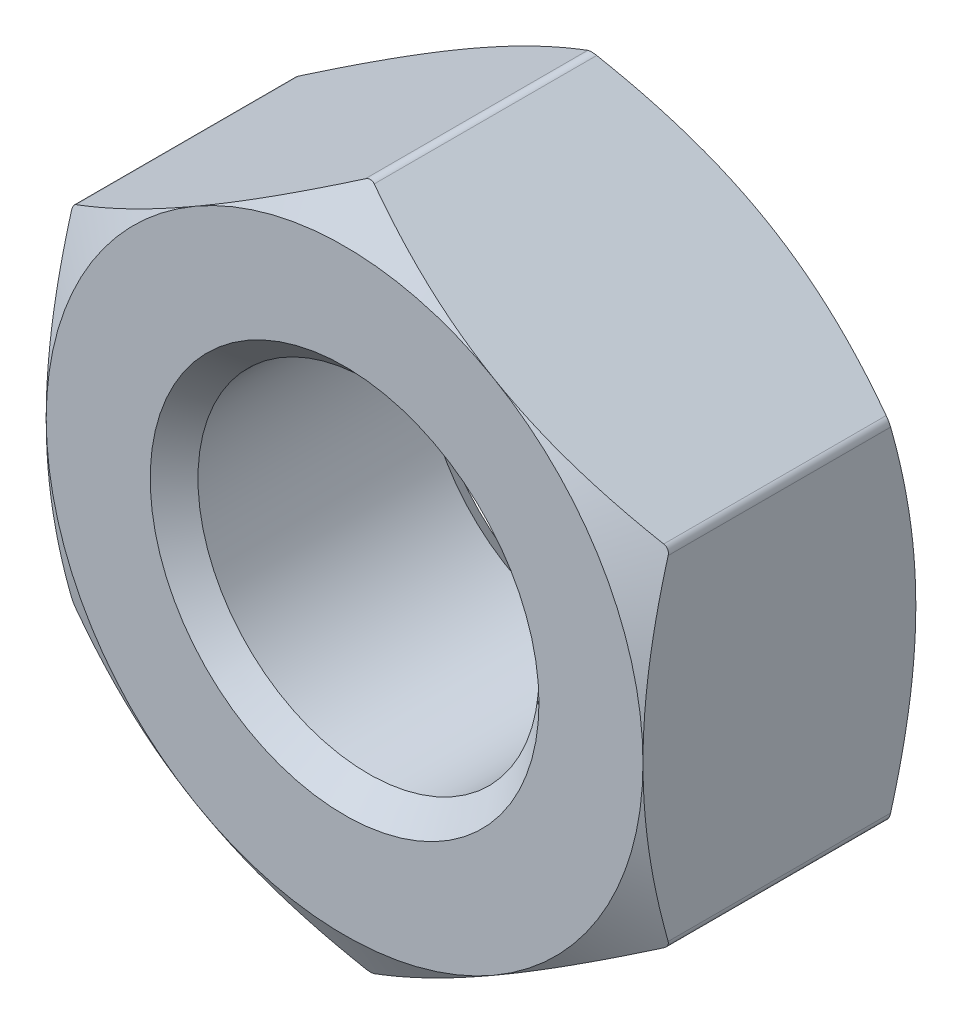
from build123d import *

# Parameters (mm, degrees)
SKETCH3_R           = 2
BOSS_EXTRUDE1_DEPTH = 1.6
SKETCH4_OUTSIDE_W   = 36.28
SKETCH4_OUTSIDE_H   = 37.362
SKETCH4_OUTSIDE_R   = 3.5
CUT_EXTRUDE1_DEPTH  = 7.23083729
CUT_EXTRUDE1_DRAFT  = -60
CUT_EXTRUDE2_START  = -3.2
SKETCH4_2_OUTSIDE_W = 47.366
SKETCH4_2_OUTSIDE_H = 48.448
SKETCH4_2_OUTSIDE_R = 3.5
CUT_EXTRUDE2_DEPTH  = 10.43083729
CUT_EXTRUDE2_DRAFT  = 60
FILLET1_R           = 0.105
CHAMFER1_SIZE       = 0.28


with BuildPart() as part:
    # Sketch3 → Boss-Extrude1 (new, symmetric)
    with BuildSketch(Plane.XY):
        Polygon((0, 4.041451884), (-3.5, 2.020725942), (-3.5, -2.020725942), (0, -4.041451884), (3.5, -2.020725942), (3.5, 2.020725942), align=None)
        Circle(SKETCH3_R, mode=Mode.SUBTRACT)
    extrude(amount=BOSS_EXTRUDE1_DEPTH, both=True)


with BuildPart() as cut_extrude1_tool:
    # Sketch4 outside → Cut-Extrude1 (with draft: the straight prism first)
    with BuildSketch(Plane.XY.offset(1.6)):
        Rectangle(SKETCH4_OUTSIDE_W, SKETCH4_OUTSIDE_H)
        Circle(SKETCH4_OUTSIDE_R, mode=Mode.SUBTRACT)
    extrude(amount=-CUT_EXTRUDE1_DEPTH)
    # Cut-Extrude1: the draft: its side faces are tilted about the plane it starts from
    cut_extrude1_sides = [cut_extrude1_tool.faces().sort_by_distance(p)[0] for p in [
        (0, -18.681, -2.015418645),
        (18.14, 0, -2.015418645),
        (0, 18.681, -2.015418645),
        (-18.14, 0, -2.015418645),
        (-3.5, 0, -2.015418645),
    ]]
    draft(cut_extrude1_sides, Plane.XY.offset(1.6), CUT_EXTRUDE1_DRAFT)


with BuildPart() as part_1:
    add(part.part)

    # Cut-Extrude1: cut by cut_extrude1_tool
    add(cut_extrude1_tool.part, mode=Mode.SUBTRACT)


with BuildPart() as cut_extrude2_tool:
    # Sketch4<2> outside → Cut-Extrude2 (with draft: the straight prism first)
    with BuildSketch(Plane.XY.offset(1.6).offset(CUT_EXTRUDE2_START)):
        Rectangle(SKETCH4_2_OUTSIDE_W, SKETCH4_2_OUTSIDE_H)
        Circle(SKETCH4_2_OUTSIDE_R, mode=Mode.SUBTRACT)
    extrude(amount=CUT_EXTRUDE2_DEPTH)
    # Cut-Extrude2: the draft: its side faces are tilted about the plane it starts from
    cut_extrude2_sides = [cut_extrude2_tool.faces().sort_by_distance(p)[0] for p in [
        (0, -24.224, 3.615418645),
        (23.683, 0, 3.615418645),
        (0, 24.224, 3.615418645),
        (-23.683, 0, 3.615418645),
        (-3.5, 0, 3.615418645),
    ]]
    draft(cut_extrude2_sides, Plane.XY.offset(1.6).offset(CUT_EXTRUDE2_START), CUT_EXTRUDE2_DRAFT)


with BuildPart() as part_2:
    add(part_1.part)

    # Cut-Extrude2: cut by cut_extrude2_tool
    add(cut_extrude2_tool.part, mode=Mode.SUBTRACT)

    # Fillet1
    fillet1_edges = [part_2.edges().sort_by_distance(p)[0] for p in [
        (3.5, -2.020725942, 0),
        (0, -4.041451884, 0),
        (-3.5, -2.020725942, 0),
        (-3.5, 2.020725942, 0),
        (0, 4.041451884, 0),
        (3.5, 2.020725942, 0),
    ]]
    fillet(fillet1_edges, radius=FILLET1_R)

    # Chamfer1
    chamfer1_edges = [part_2.edges().sort_by_distance(p)[0] for p in [
        (-2, 0, -1.6),
        (-2, 0, 1.6),
    ]]
    chamfer(chamfer1_edges, length=CHAMFER1_SIZE)


solid = part_2.part
